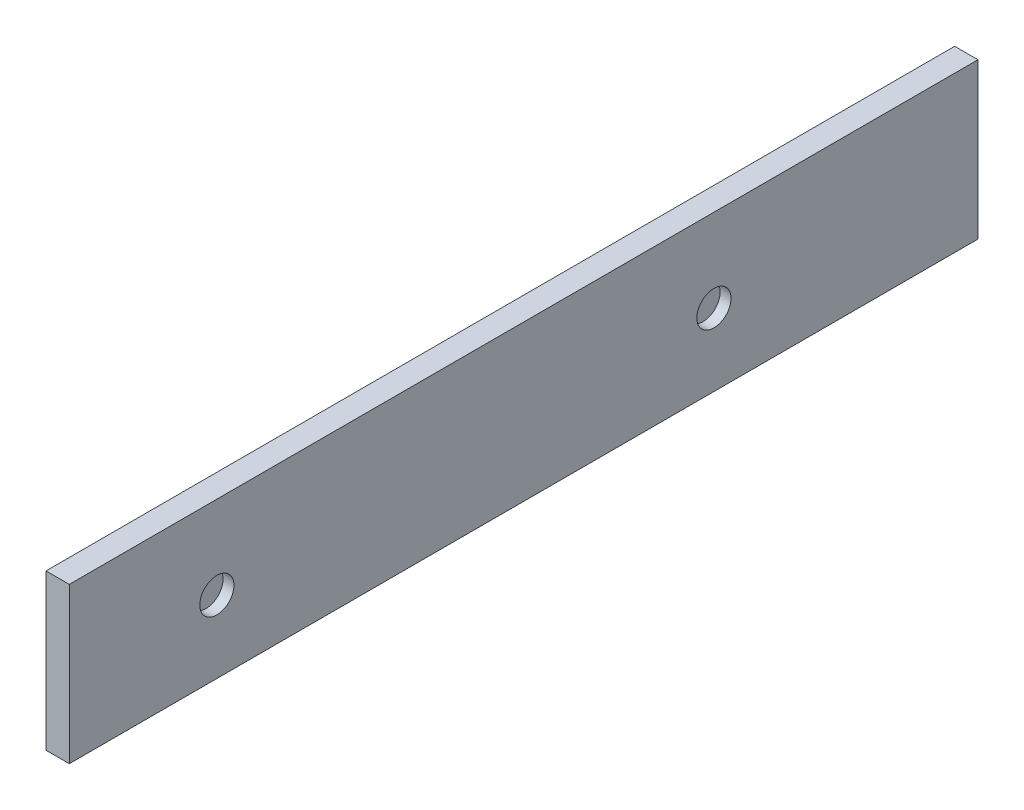
from build123d import *

# Parameters (mm, degrees)
CROQUIS1_W              = 585
CROQUIS1_H              = 100
SALIENTE_EXTRUIR1_DEPTH = 15
CROQUIS2_R              = 11
CORTAR_EXTRUIR1_DEPTH   = 7


with BuildPart() as part:
    # Croquis1 → Saliente-Extruir1 (new body)
    with BuildSketch(Plane(origin=(0, 0, 0), x_dir=(0, 0, -1), z_dir=(1, 0, 0))):
        with Locations((292.5, 50)):
            Rectangle(CROQUIS1_W, CROQUIS1_H)
    extrude(amount=SALIENTE_EXTRUIR1_DEPTH)

    # Croquis2 → Cortar-Extruir1 (cut)
    with BuildSketch(Plane(origin=(15, 0, 0), x_dir=(0, 0, -1), z_dir=(1, 0, 0))):
        with Locations((95, 46.5)):
            Circle(CROQUIS2_R)
        with Locations((415, 46.5)):
            Circle(CROQUIS2_R)
    extrude(amount=-CORTAR_EXTRUIR1_DEPTH, mode=Mode.SUBTRACT)


solid = part.part
